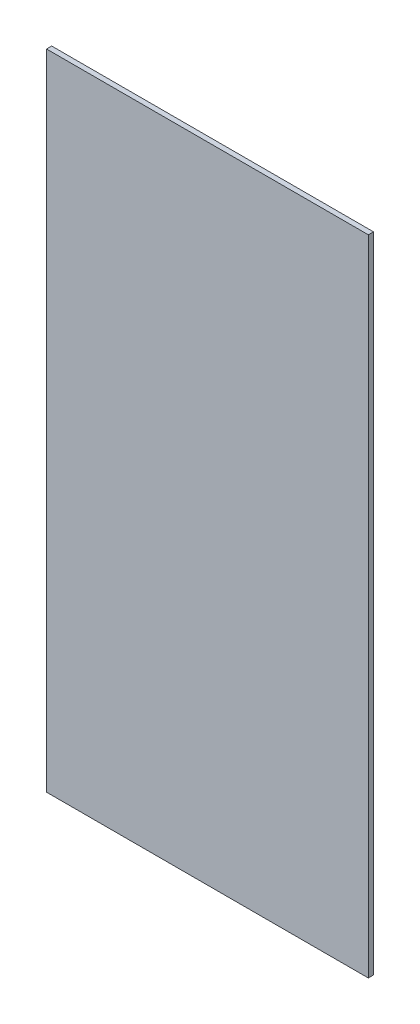
from build123d import *

# Parameters (mm, degrees)
SKETCH1_W           = 250
SKETCH1_H           = 500
BOSS_EXTRUDE1_DEPTH = 4


with BuildPart() as part:
    # Sketch1 → Boss-Extrude1 (new body)
    with BuildSketch(Plane.XY):
        Rectangle(SKETCH1_W, SKETCH1_H)
    extrude(amount=BOSS_EXTRUDE1_DEPTH)


solid = part.part
